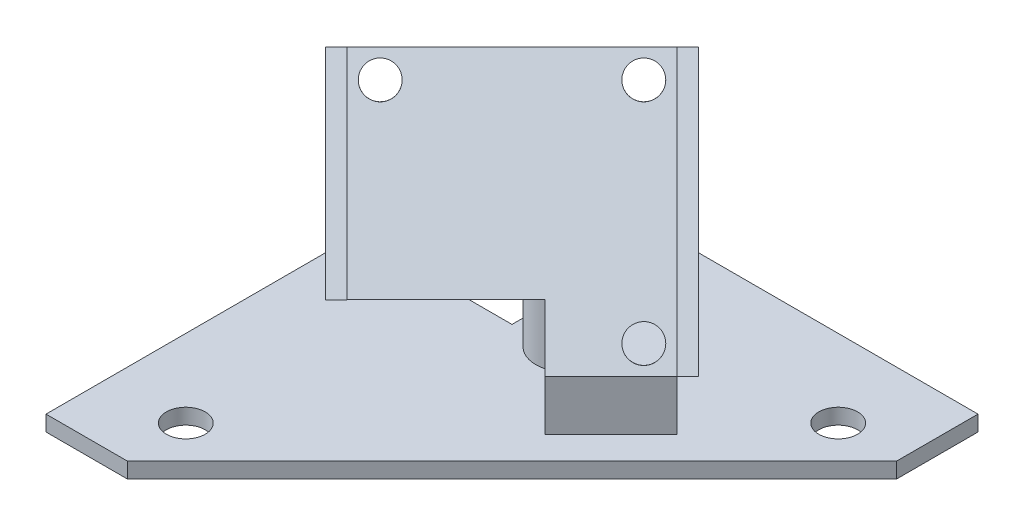
from build123d import *

# Parameters (mm, degrees)
SKETCH_1_R                  = 2.5
EXTRUDE_1_DEPTH             = 2
SKETCH_2_R                  = 2
EXTRUDE_3_DEPTH             = 2
EXTRUDE_4_REACH             = 93.431
SKETCH_4_R                  = 4
EXTRUDE_5_REACH             = 93.431
EXTRUDE_6_REACH             = 56.956
EXTRUDE_6_DIRECTION_2_DEPTH = 3
SKETCH_7_R                  = 2.5
EXTRUDE_8_DEPTH             = 3
CUT_EXTRUDE_1_DEPTH         = 3


with BuildPart() as part:
    # 草图1 → 凸台-拉伸1 (new body)
    with BuildSketch(Plane(origin=(0, 0, 0), x_dir=(1, 0, 0), z_dir=(0, 1, 0))):
        Polygon((10.502525317, -60), (60, -10.502525317), (60, 0), (20, 0), (20, -20), (0, -20), (0, -60), align=None)
        with Locations(Location((10, -52, 0), (0, 0, 270))):
            Circle(SKETCH_1_R, mode=Mode.SUBTRACT)
        with Locations(Location((52, -10, 0), (0, 0, 270))):
            Circle(SKETCH_1_R, mode=Mode.SUBTRACT)
    extrude(amount=EXTRUDE_1_DEPTH)



with BuildPart() as body_2:
    # 草图2 → 凸台-拉伸3 (new body)
    with BuildSketch(Plane(origin=(24.318415307, 24.081140456, 24.318415307), x_dir=(-0.7071067811865475, 0, 0.7071067811865476), z_dir=(0.5792279653395701, 0.5735764363510444, 0.57922796533957))):
        Polygon((-3, 16.786030205), (-15, 16.786030205), (-15, -13.213969795), (15, -13.213969795), (15, 9.786030205), (-3, 9.786030205), align=None)
        with Locations(Location((-12, -10.213969795, 0), (0, 0, 180))):
            Circle(SKETCH_2_R, mode=Mode.SUBTRACT)
        with Locations(Location((12, -10.213969795, 0), (0, 0, 180))):
            Circle(SKETCH_2_R, mode=Mode.SUBTRACT)
        with Locations(Location((-12, 13.786030205, 0), (0, 0, 180))):
            Circle(SKETCH_2_R, mode=Mode.SUBTRACT)
    extrude(amount=EXTRUDE_3_DEPTH)


with BuildPart() as part_1:
    add(part.part)

    add(body_2.part)  # 凸台-拉伸4 merges body 2
    # 凸台-拉伸4: up to this plane
    extrude_4_end = Plane(origin=(24.318415307, 24.081140456, 24.318415307), z_dir=(0.5792279653395702, 0.5735764363510445, 0.5792279653395699))
    # 草图4 → 凸台-拉伸4 (add, up to the surface)
    with BuildSketch(Plane(origin=(0, 2, 0), x_dir=(1, 0, 0), z_dir=(0, 1, 0)), mode=Mode.PRIVATE) as extrude_4_sk1:
        with Locations(Location((26.030164055, -18.959096243, 0), (0, 0, 315))):
            Circle(SKETCH_4_R)
    extrude_4_tool1 = split(extrude(extrude_4_sk1.sketch, amount=EXTRUDE_4_REACH, mode=Mode.PRIVATE), bisect_by=extrude_4_end, keep=Keep.BOTH, mode=Mode.PRIVATE)
    add(extrude_4_tool1.solids().sort_by_distance((26.030164, 2, 18.959096))[0])

    # 草图5 → 凸台-拉伸5 (add, up to next)
    with BuildSketch(Plane(origin=(0, 2, 0), x_dir=(1, 0, 0), z_dir=(0, 1, 0)), mode=Mode.PRIVATE) as extrude_5_sk1:
        Polygon((41.733091591, -20.519888156), (33.247810217, -29.00516953), (34.406266148, -30.16362546), (42.891547522, -21.678344086), align=None)
    extrude_5_tool1 = extrude(extrude_5_sk1.sketch, amount=EXTRUDE_5_REACH, mode=Mode.PRIVATE) - part_1.part
    add(extrude_5_tool1.solids().sort_by_distance((38.069679, 2, 25.341757))[0])

    # 凸台-拉伸6: up to this face of the body (flat: up to its plane)
    extrude_6_end = Plane(part_1.part.faces().sort_by_distance((24.757422588, 23.562214363, 24.393270957))[0])
    # 草图6 → 凸台-拉伸6 (add, up to the picked face)
    with BuildSketch(Plane(origin=(25.476871238, 25.228293329, 25.476871238), x_dir=(0.45107473692648714, 0.36633593098762024, -0.8138363271408656), z_dir=(0.5792279653395703, 0.5735764363510442, 0.5792279653395701)), mode=Mode.PRIVATE) as extrude_6_sk1:
        Polygon((-7.506940922, 18.527137818), (-17.792853619, -2.044687575), (-19.581708001, -1.150260384), (-9.295795304, 19.421565009), align=None)
    extrude_6_tool1 = split(extrude(extrude_6_sk1.sketch, amount=-EXTRUDE_6_REACH, mode=Mode.PRIVATE), bisect_by=extrude_6_end, keep=Keep.BOTH, mode=Mode.PRIVATE)
    # 草图6 → 凸台-拉伸6 (add, up to the picked face)
    with BuildSketch(Plane(origin=(25.476871238, 25.228293329, 25.476871238), x_dir=(0.45107473692648714, 0.36633593098762024, -0.8138363271408656), z_dir=(0.5792279653395703, 0.5735764363510442, 0.5792279653395701)), mode=Mode.PRIVATE) as extrude_6_sk2:
        Polygon((19.325874808, 5.110729953), (5.909466943, -21.722085777), (7.698321325, -22.616512968), (21.11472919, 4.216302762), align=None)
    extrude_6_tool2 = split(extrude(extrude_6_sk2.sketch, amount=-EXTRUDE_6_REACH, mode=Mode.PRIVATE), bisect_by=extrude_6_end, keep=Keep.BOTH, mode=Mode.PRIVATE)
    add(extrude_6_tool1.solids().sort_by(Axis((13.468011, 26.632295, 36.095428), (-0.5792279653395703, -0.5735764363510442, -0.5792279653395701)))[0])
    add(extrude_6_tool2.solids().sort_by(Axis((37.514957, 23.765263, 14.88754), (-0.5792279653395703, -0.5735764363510442, -0.5792279653395701)))[0])

    # 草图6 → 凸台-拉伸6 direction 2 (add)
    with BuildSketch(Plane(origin=(25.476871238, 25.228293329, 25.476871238), x_dir=(0.45107473692648714, 0.36633593098762024, -0.8138363271408656), z_dir=(0.5792279653395703, 0.5735764363510442, 0.5792279653395701))):
        Polygon((-7.506940922, 18.527137818), (-17.792853619, -2.044687575), (-19.581708001, -1.150260384), (-9.295795304, 19.421565009), align=None)
        Polygon((19.325874808, 5.110729953), (5.909466943, -21.722085777), (7.698321325, -22.616512968), (21.11472919, 4.216302762), align=None)
    extrude(amount=EXTRUDE_6_DIRECTION_2_DEPTH)

    # 草图7 → 凸台-拉伸8 (add)
    with BuildSketch(Plane(origin=(0, 2, 0), x_dir=(1, 0, 0), z_dir=(0, 1, 0))):
        Polygon((60, 0), (20, 0), (20, -20), (0, -20), (0, -60), (10.502525317, -60), (60, -10.502525317), align=None)
        with Locations(Location((10, -52, 0), (0, 0, 270))):
            Circle(SKETCH_7_R, mode=Mode.SUBTRACT)
        with Locations(Location((52, -10, 0), (0, 0, 270))):
            Circle(SKETCH_7_R, mode=Mode.SUBTRACT)
    extrude(amount=EXTRUDE_8_DEPTH)

    # 草图10 → 切除-拉伸1 (cut)
    with BuildSketch(Plane.XZ):
        Polygon((20, 0), (60, 0), (60, 10.502525317), (10.502525317, 60), (0, 60), (0, 20), (20, 20), align=None)
    extrude(amount=-CUT_EXTRUDE_1_DEPTH, mode=Mode.SUBTRACT)


solid = part_1.part
